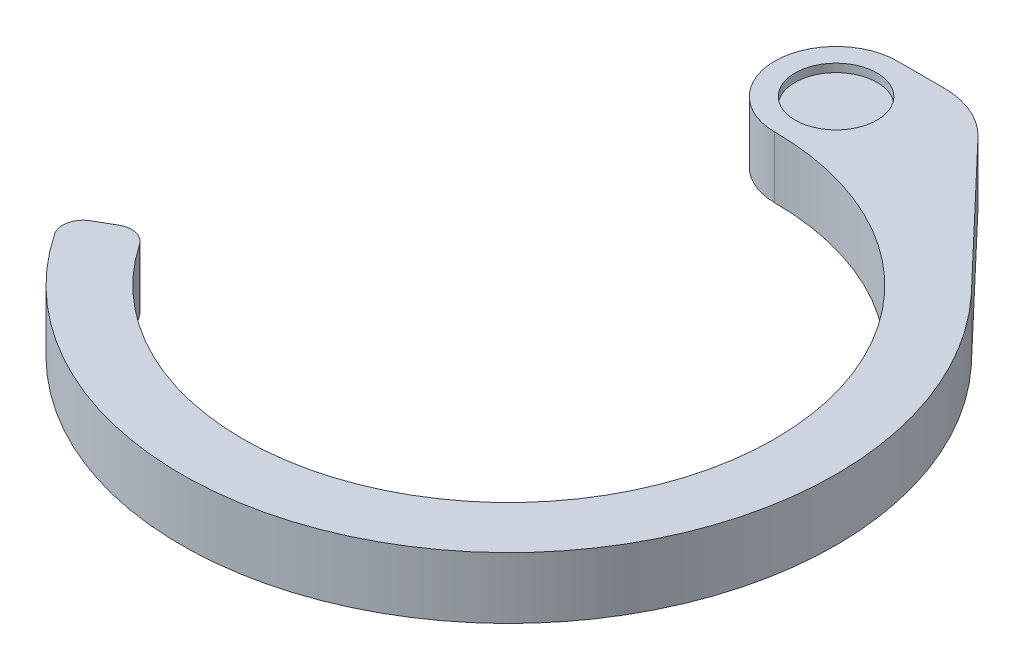
from build123d import *

# Parameters (mm, degrees)
EXTRUDE_4_DEPTH     = 15
SKETCH_3_R          = 10
CUT_EXTRUDE_1_DEPTH = 2


with BuildPart() as part:
    # ｽｹｯﾁ2 → ﾎﾞｽ - 押し出し4 (new body)
    with BuildSketch(Plane(origin=(0, 0, 0), x_dir=(1, 0, 0), z_dir=(0, 1, 0))):
        with BuildLine():
            ThreePointArc((-53.82643789, -36.437818048), (-56.846261527, -34.367935813), (-60.466933112, -34.910600109))
            Line((-60.466933112, -34.910600109), (-64.807406984, -37.416573868))
            ThreePointArc((-64.807406984, -37.416573868), (-67.177509772, -40.614402853), (-66.461234116, -44.529814279))
            ThreePointArc((-66.461234116, -44.529814279), (49.665387485, -62.716419588), (58.57572973, 54.487465409))
            Line((58.57572973, 54.487465409), (57.289371136, 55.838409315))
            Line((57.289371136, 55.838409315), (25.911523347, 88.791671712))
            ThreePointArc((25.911523347, 88.791671712), (19.306695871, 93.382511176), (11.427401304, 95))
            Line((11.427401304, 95), (0, 95))
            ThreePointArc((0, 95), (-15, 80), (0, 65))
            ThreePointArc((0, 65), (57.41714976, -30.467538684), (-53.82643789, -36.437818048))
        make_face()
    extrude(amount=EXTRUDE_4_DEPTH)

    # ｽｹｯﾁ3 → ｶｯﾄ - 押し出し1 (cut)
    with BuildSketch(Plane(origin=(0, 15, 0), x_dir=(1, 0, 0), z_dir=(0, 1, 0))):
        with Locations(Location((0, 80, 0), (0, 0, 270))):
            Circle(SKETCH_3_R)
    extrude(amount=-CUT_EXTRUDE_1_DEPTH, mode=Mode.SUBTRACT)


solid = part.part
